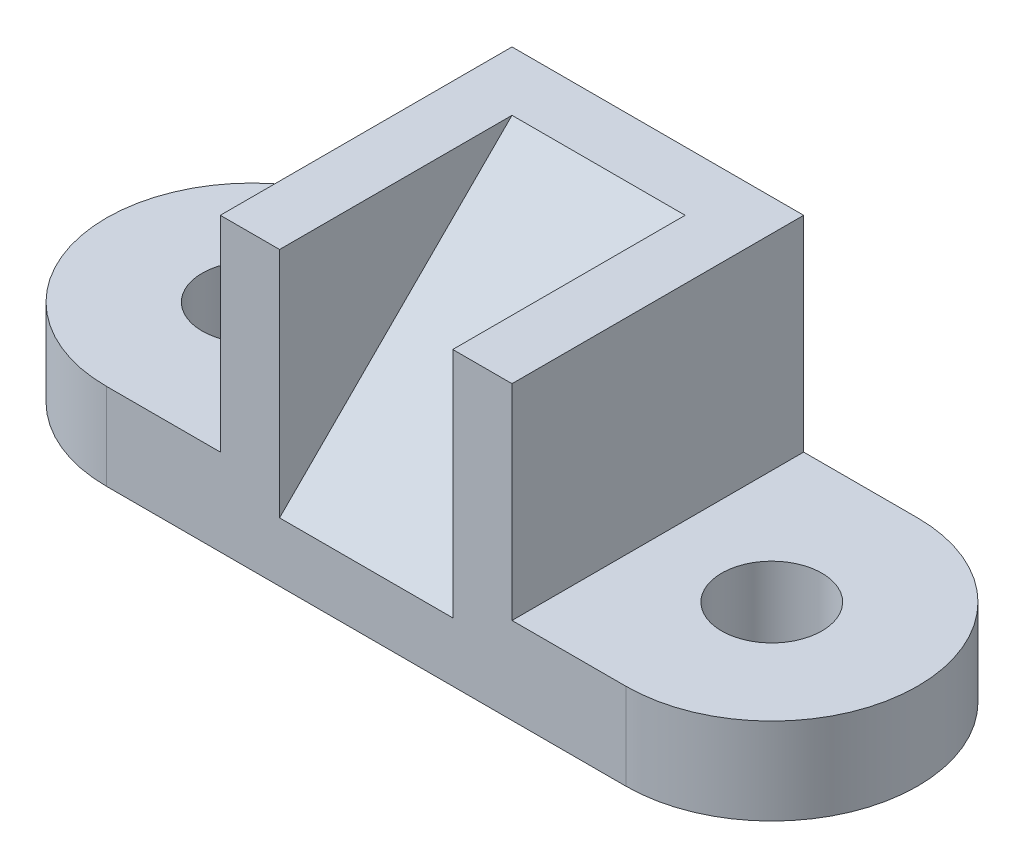
from build123d import *

# Parameters (mm, degrees)
SKETCH1_R           = 11
BOSS_EXTRUDE1_DEPTH = 19
SKETCH2_W           = 64
SKETCH2_H           = 64
BOSS_EXTRUDE2_DEPTH = 45
CUT_EXTRUDE1_DEPTH  = 19


with BuildPart() as part:
    # Sketch1 → Boss-Extrude1 (new body)
    with BuildSketch(Plane(origin=(0, 0, 0), x_dir=(1, 0, 0), z_dir=(0, 1, 0))):
        with BuildLine():
            Line((0, -32), (114, -32))
            ThreePointArc((114, -32), (146, 0), (114, 32))
            Line((114, 32), (0, 32))
            ThreePointArc((0, 32), (-32, 0), (0, -32))
        make_face()
        with Locations(Location((0, 0, 0), (0, 0, 270))):
            Circle(SKETCH1_R, mode=Mode.SUBTRACT)
        with Locations(Location((114, 0, 0), (0, 0, 270))):
            Circle(SKETCH1_R, mode=Mode.SUBTRACT)
    extrude(amount=BOSS_EXTRUDE1_DEPTH)

    # Sketch2 → Boss-Extrude2 (add)
    with BuildSketch(Plane(origin=(0, 19, 0), x_dir=(1, 0, 0), z_dir=(0, 1, 0))):
        with Locations((57, 0)):
            Rectangle(SKETCH2_W, SKETCH2_H)
    extrude(amount=BOSS_EXTRUDE2_DEPTH)

    # Sketch3 → Cut-Extrude1 (cut, symmetric)
    with BuildSketch(Plane.ZY.offset(-57)):
        Polygon((32, 64), (-19, 64), (32, 13), align=None)
    extrude(amount=CUT_EXTRUDE1_DEPTH, both=True, mode=Mode.SUBTRACT)


solid = part.part
